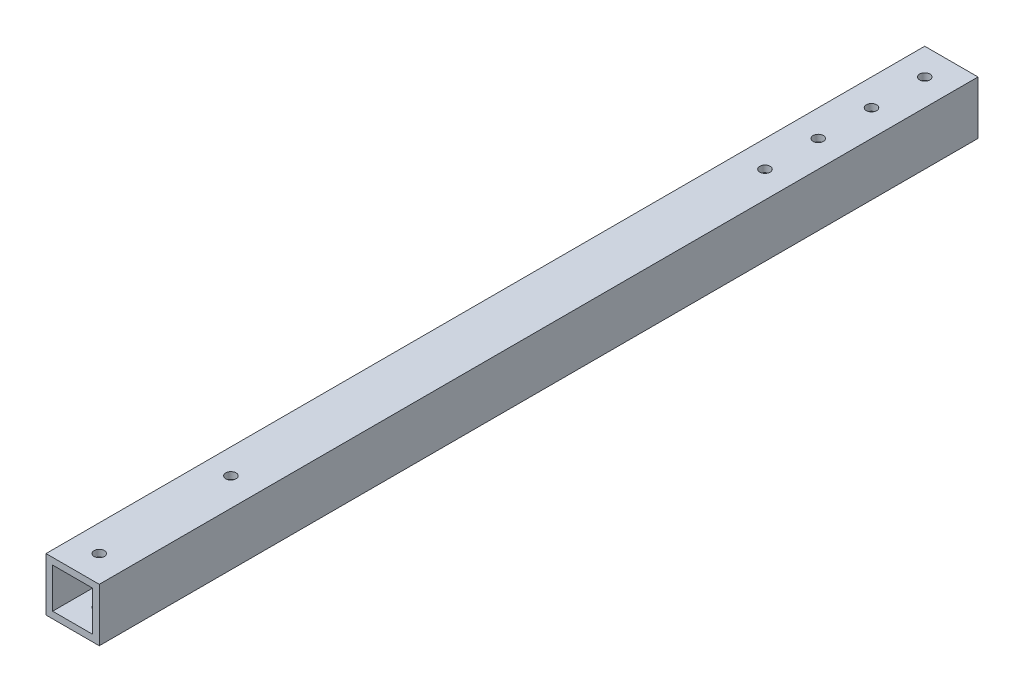
from build123d import *

# Parameters (mm, degrees)
SKETCH1_W                        = 25.4
SKETCH1_H                        = 25.4
SKETCH1_W_2                      = 19.05
SKETCH1_H_2                      = 19.05
BOSS_EXTRUDE1_DEPTH              = 241.3
F_10_0_1935_DIAMETER_HOLE1_D     = 4.9149
F_10_0_1935_DIAMETER_HOLE1_DEPTH = 50.8
F_10_0_1935_DIAMETER_HOLE1_TIP   = 1.476584928
SKETCH5_R                        = 2.464210786
CUT_EXTRUDE1_DEPTH               = 243.965306165
SKETCH6_W                        = 25.4
SKETCH6_H                        = 63.5
CUT_EXTRUDE2_DEPTH               = 243.965306165


with BuildPart() as part:
    # Sketch1 → Boss-Extrude1 (new, symmetric)
    with BuildSketch(Plane.XY):
        Rectangle(SKETCH1_W, SKETCH1_H)
        Rectangle(SKETCH1_W_2, SKETCH1_H_2, mode=Mode.SUBTRACT)
    extrude(amount=BOSS_EXTRUDE1_DEPTH, both=True)

    # #10 (0.1935) Diameter Hole1
    with Locations(Plane(origin=(0, 12.7, 0), x_dir=(1, 0, 0), z_dir=(0, 1, 0))):
        with Locations((0, -228.6), (0, 88.9), (0, 114.3), (0, 139.7), (0, 165.1), (0, 190.5), (0, 215.9)):
            Hole(F_10_0_1935_DIAMETER_HOLE1_D / 2, depth=F_10_0_1935_DIAMETER_HOLE1_DEPTH)
            with Locations((0, 0, -(F_10_0_1935_DIAMETER_HOLE1_DEPTH + F_10_0_1935_DIAMETER_HOLE1_TIP / 2))):  # 118° drill point
                Cone(0, F_10_0_1935_DIAMETER_HOLE1_D / 2, F_10_0_1935_DIAMETER_HOLE1_TIP, mode=Mode.SUBTRACT)

    # Sketch5 → Cut-Extrude1 (cut, through all)
    with BuildSketch(Plane(origin=(0, 12.7, 0), x_dir=(1, 0, 0), z_dir=(0, 1, 0))):
        with Locations(Location((-0.70643934, -165.103929701, 0), (0, 0, 180))):
            Circle(SKETCH5_R)
    extrude(amount=-CUT_EXTRUDE1_DEPTH, mode=Mode.SUBTRACT)

    # Sketch6 → Cut-Extrude2 (cut, through all)
    with BuildSketch(Plane(origin=(0, 12.7, 0), x_dir=(1, 0, 0), z_dir=(0, 1, 0))):
        with Locations((0, 209.55)):
            Rectangle(SKETCH6_W, SKETCH6_H)
    extrude(amount=-CUT_EXTRUDE2_DEPTH, mode=Mode.SUBTRACT)


solid = part.part
